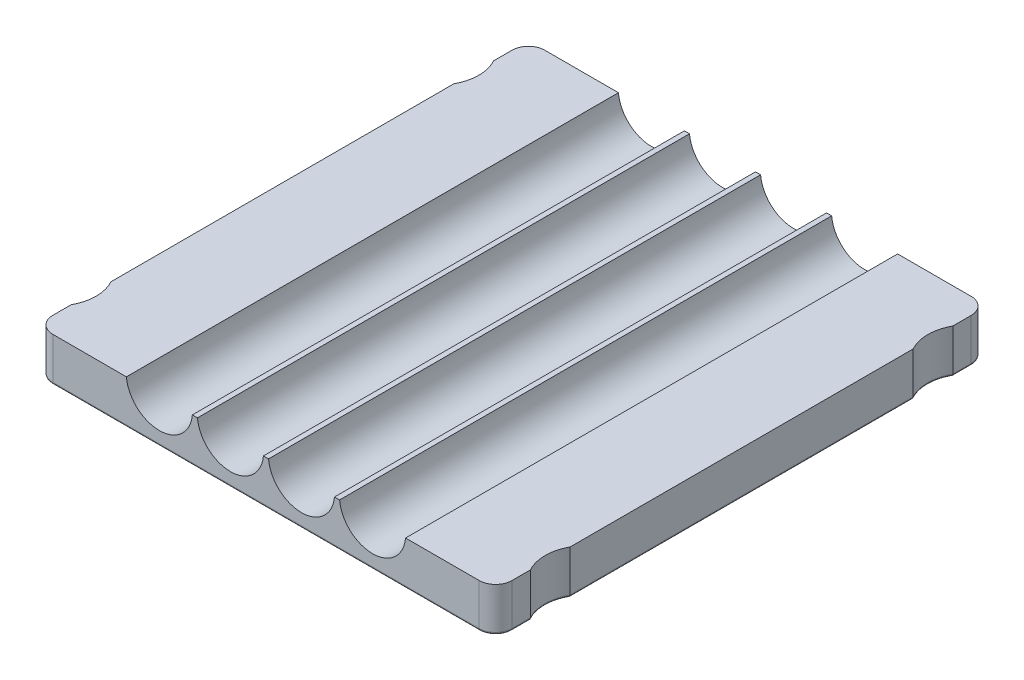
from build123d import *

# Parameters (mm, degrees)
BOSS_EXTRUDE1_DEPTH     = 0.5
BOSS_EXTRUDE2_DEPTH     = 4
FILLET1_R               = 0.2
CUT_EXTRUDE1_DEPTH      = 32.104662098
CUT_EXTRUDE1_DEPTH_BACK = 32.104662098
SKETCH3_R               = 3.03


with BuildPart() as part:
    # Sketch1 → Boss-Extrude1 (new body)
    with BuildSketch(Plane(origin=(0, 0, 0), x_dir=(1, 0, 0), z_dir=(0, 1, 0))):
        with BuildLine():
            Line((-19, 17.5), (-19, -17.5))
            ThreePointArc((-19, -17.5), (-18.267766953, -19.267766953), (-16.5, -20))
            Line((-16.5, -20), (16.5, -20))
            ThreePointArc((16.5, -20), (18.267766953, -19.267766953), (19, -17.5))
            Line((19, -17.5), (19, 17.5))
            ThreePointArc((19, 17.5), (18.267766953, 19.267766953), (16.5, 20))
            Line((16.5, 20), (-16.5, 20))
            ThreePointArc((-16.5, 20), (-18.267766953, 19.267766953), (-19, 17.5))
        make_face()
    extrude(amount=BOSS_EXTRUDE1_DEPTH)

    # Sketch2 → Boss-Extrude2 (add)
    with BuildSketch(Plane(origin=(0, 0.5, 0), x_dir=(1, 0, 0), z_dir=(0, 1, 0))):
        with BuildLine():
            Line((-19.5, 22.5), (19.5, 22.5))
            ThreePointArc((19.5, 22.5), (20.560660172, 22.060660172), (21, 21))
            Line((21, 21), (21, 19.314104738))
            ThreePointArc((21, 19.314104738), (20.532, 17.5), (21, 15.685895262))
            Line((21, 15.685895262), (21, -15.685895262))
            ThreePointArc((21, -15.685895262), (20.532, -17.5), (21, -19.314104738))
            Line((21, -19.314104738), (21, -21))
            ThreePointArc((21, -21), (20.560660172, -22.060660172), (19.5, -22.5))
            Line((19.5, -22.5), (-19.5, -22.5))
            ThreePointArc((-19.5, -22.5), (-20.560660172, -22.060660172), (-21, -21))
            Line((-21, -21), (-21, -19.314104738))
            ThreePointArc((-21, -19.314104738), (-20.532, -17.5), (-21, -15.685895262))
            Line((-21, -15.685895262), (-21, 15.685895262))
            ThreePointArc((-21, 15.685895262), (-20.532, 17.5), (-21, 19.314104738))
            Line((-21, 19.314104738), (-21, 21))
            ThreePointArc((-21, 21), (-20.560660172, 22.060660172), (-19.5, 22.5))
        make_face()
    extrude(amount=BOSS_EXTRUDE2_DEPTH)

    # Fillet1
    fillet1_edges = [part.edges().sort_by_distance(p)[0] for p in [
        (0, 0, 20),
        (-18.267766953, 0, 19.267766953),
        (-20.532, 0.5, 17.5),
        (-21, 0.5, 20.157052369),
        (-20.560660172, 0.5, 22.060660172),
        (0, 0.5, 22.5),
        (20.560660172, 0.5, 22.060660172),
        (21, 0.5, 20.157052369),
        (20.532, 0.5, 17.5),
        (21, 0.5, 0),
        (20.532, 0.5, -17.5),
        (21, 0.5, -20.157052369),
        (20.560660172, 0.5, -22.060660172),
        (0, 0.5, -22.5),
        (-20.560660172, 0.5, -22.060660172),
        (-21, 0.5, -20.157052369),
        (-20.532, 0.5, -17.5),
        (-21, 0.5, 0),
        (-19, 0, 0),
        (-18.267766953, 0, -19.267766953),
        (0, 0, -20),
        (18.267766953, 0, -19.267766953),
        (19, 0, 0),
        (18.267766953, 0, 19.267766953),
    ]]
    fillet(fillet1_edges, radius=FILLET1_R)

    # Sketch3 → Cut-Extrude1 (cut, two sides: drawn at the far end of the back side and taken through both)
    with BuildSketch(Plane.XY.offset(-CUT_EXTRUDE1_DEPTH_BACK)):
        with Locations((9.75, 4.78)):
            Circle(SKETCH3_R)
        with Locations((3.25, 4.78)):
            Circle(SKETCH3_R)
        with Locations((-3.25, 4.78)):
            Circle(SKETCH3_R)
        with Locations((-9.75, 4.78)):
            Circle(SKETCH3_R)
    extrude(amount=CUT_EXTRUDE1_DEPTH + CUT_EXTRUDE1_DEPTH_BACK, mode=Mode.SUBTRACT)


solid = part.part
